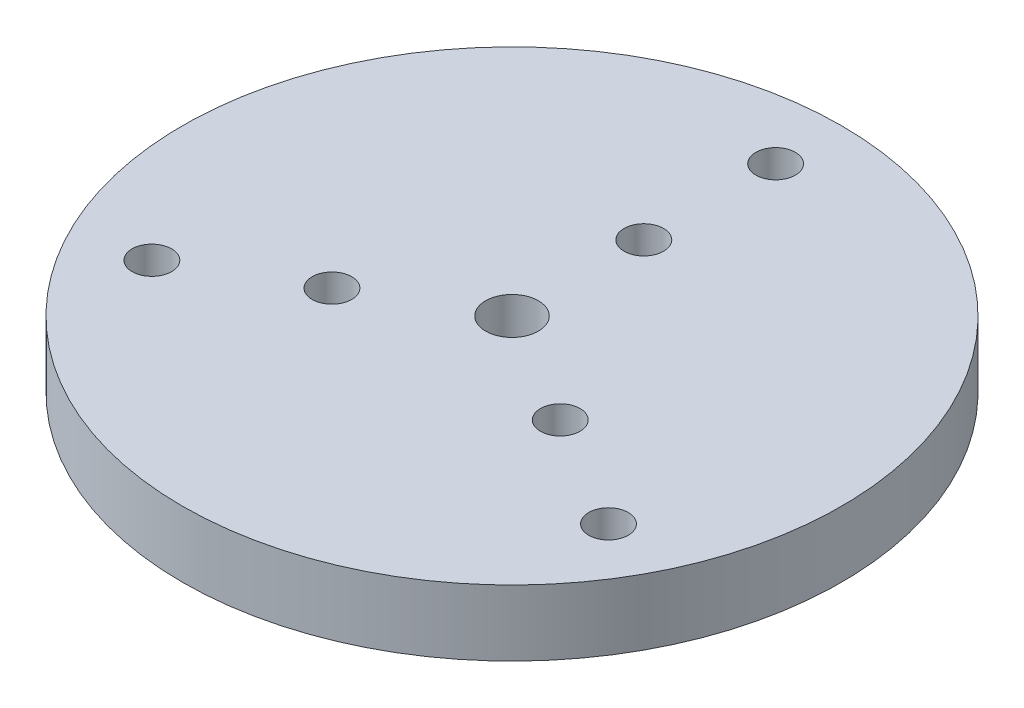
from build123d import *

# Parameters (mm, degrees)
SKETCH1_R           = 50
SKETCH1_R_2         = 4
SKETCH1_R_3         = 3
BOSS_EXTRUDE1_DEPTH = 10


with BuildPart() as part:
    # Sketch1 → Boss-Extrude1 (new body)
    with BuildSketch(Plane(origin=(0, 0, 0), x_dir=(1, 0, 0), z_dir=(0, 1, 0))):
        with Locations(Location((0, 0, 0), (0, 0, 270))):
            Circle(SKETCH1_R)
        with Locations(Location((0, 0, 0), (0, 0, 270))):
            Circle(SKETCH1_R_2, mode=Mode.SUBTRACT)
        with Locations(Location((0, 40, 0), (0, 0, 270))):
            Circle(SKETCH1_R_3, mode=Mode.SUBTRACT)
        with Locations(Location((0, 20, 0), (0, 0, 270))):
            Circle(SKETCH1_R_3, mode=Mode.SUBTRACT)
        with Locations(Location((34.641016151, -20, 0), (0, 0, 270))):
            Circle(SKETCH1_R_3, mode=Mode.SUBTRACT)
        with Locations(Location((17.320508076, -10, 0), (0, 0, 270))):
            Circle(SKETCH1_R_3, mode=Mode.SUBTRACT)
        with Locations(Location((-34.641016151, -20, 0), (0, 0, 270))):
            Circle(SKETCH1_R_3, mode=Mode.SUBTRACT)
        with Locations(Location((-17.320508076, -10, 0), (0, 0, 270))):
            Circle(SKETCH1_R_3, mode=Mode.SUBTRACT)
    extrude(amount=BOSS_EXTRUDE1_DEPTH)


solid = part.part
